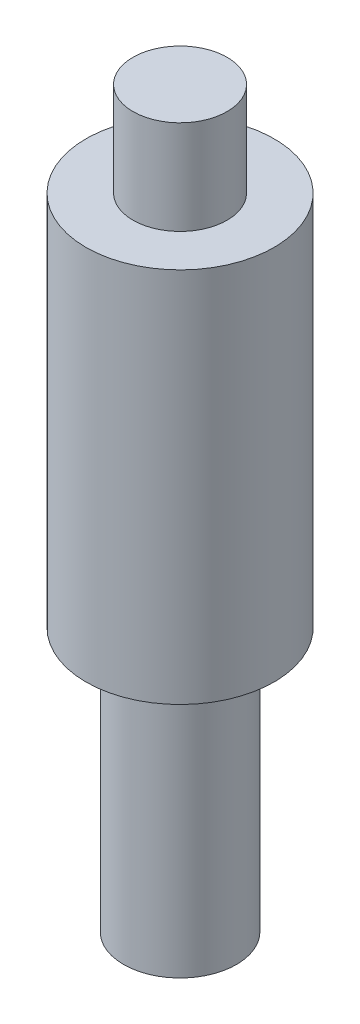
from build123d import *

# Parameters (mm, degrees)
SKETCH_1_R      = 1.5
EXTRUDE_1_DEPTH = 7
SKETCH_2_R      = 2.5
EXTRUDE_2_DEPTH = 10
SKETCH_3_R      = 1.25
EXTRUDE_3_DEPTH = 2.5


with BuildPart() as part:
    # 草图1 → 凸台-拉伸1 (new body)
    with BuildSketch(Plane(origin=(0, 0, 0), x_dir=(1, 0, 0), z_dir=(0, 1, 0))):
        with Locations(Location((0, 0, 0), (0, 0, 270))):
            Circle(SKETCH_1_R)
    extrude(amount=EXTRUDE_1_DEPTH)

    # 草图2 → 凸台-拉伸2 (add)
    with BuildSketch(Plane(origin=(0, 7, 0), x_dir=(1, 0, 0), z_dir=(0, 1, 0))):
        with Locations(Location((0, 0, 0), (0, 0, 270))):
            Circle(SKETCH_2_R)
    extrude(amount=EXTRUDE_2_DEPTH)

    # 草图3 → 凸台-拉伸3 (add)
    with BuildSketch(Plane(origin=(0, 17, 0), x_dir=(1, 0, 0), z_dir=(0, 1, 0))):
        with Locations(Location((0, 0, 0), (0, 0, 270))):
            Circle(SKETCH_3_R)
    extrude(amount=EXTRUDE_3_DEPTH)


solid = part.part
